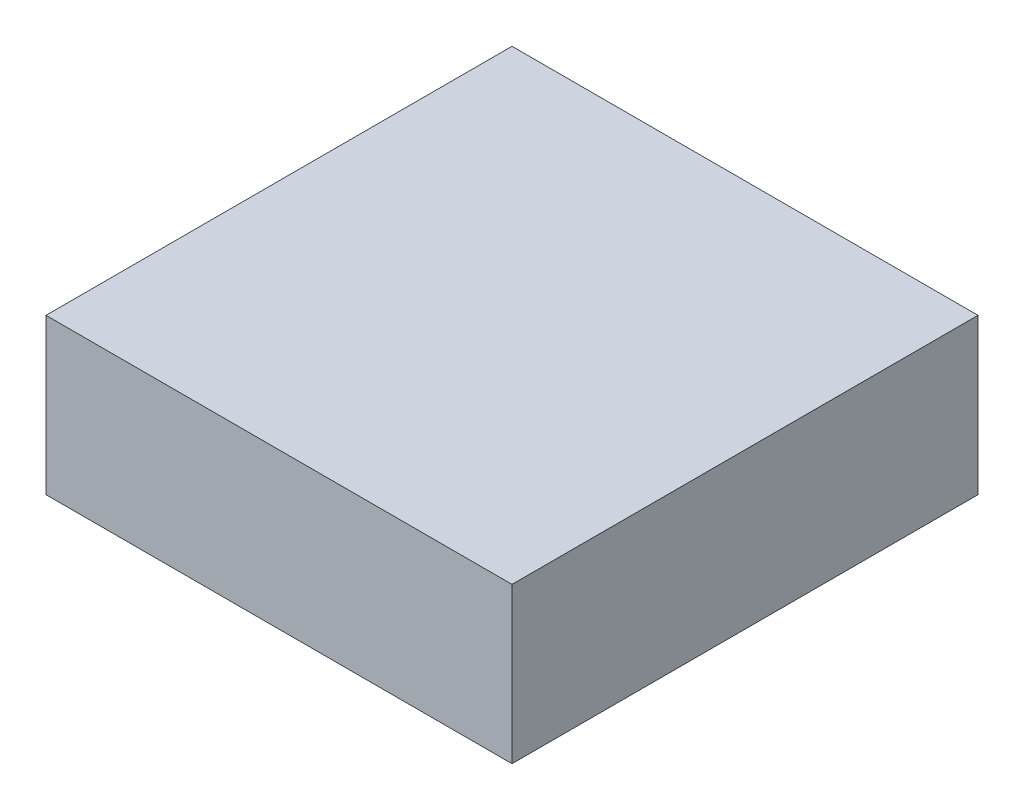
from build123d import *

# Parameters (mm, degrees)
SKETCH_1_W      = 1200
SKETCH_1_H      = 1200
EXTRUDE_1_DEPTH = 400


with BuildPart() as part:
    # 草图1 → 凸台-拉伸1 (new body)
    with BuildSketch(Plane(origin=(0, 0, 0), x_dir=(1, 0, 0), z_dir=(0, 1, 0))):
        Rectangle(SKETCH_1_W, SKETCH_1_H)
    extrude(amount=EXTRUDE_1_DEPTH)


solid = part.part
